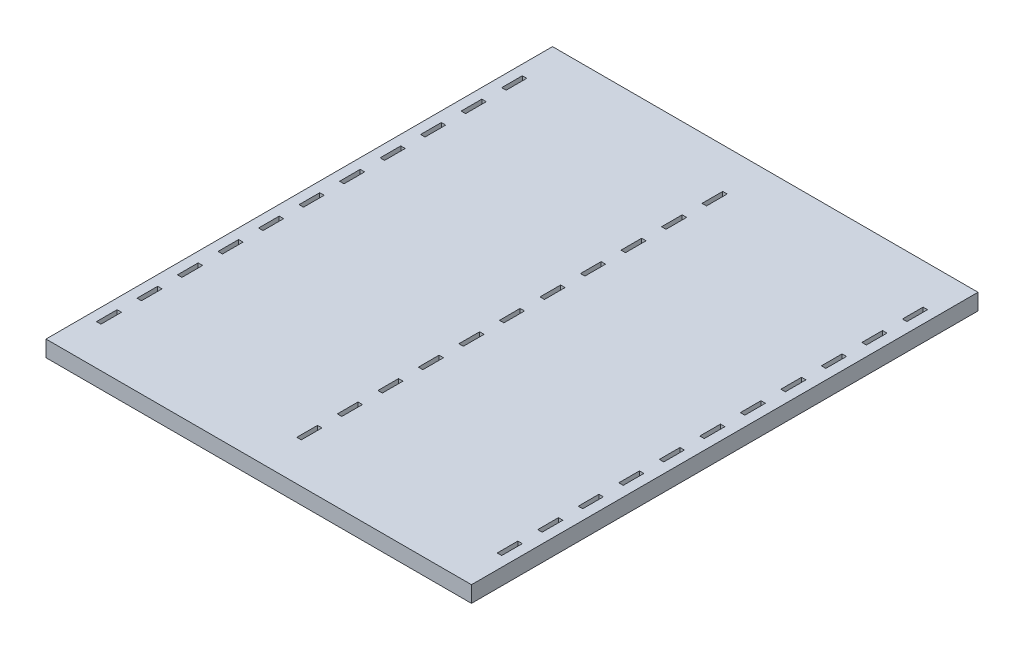
from build123d import *

# Parameters (mm, degrees)
SKETCH1_W           = 210
SKETCH1_H           = 250
BOSS_EXTRUDE1_DEPTH = 8
SKETCH_2_W          = 2.2
SKETCH_2_H          = 10.2
CUT_EXTRUDE_3_DEPTH = 164.444180074


with BuildPart() as part:
    # Sketch1 → Boss-Extrude1 (new body)
    with BuildSketch(Plane(origin=(0, 0, 0), x_dir=(1, 0, 0), z_dir=(0, 1, 0))):
        Rectangle(SKETCH1_W, SKETCH1_H)
    extrude(amount=BOSS_EXTRUDE1_DEPTH)

    # 草图2 → 切除-拉伸3 (cut, through all)
    with BuildSketch(Plane(origin=(0, 8, 0), x_dir=(1, 0, 0), z_dir=(0, 1, 0))):
        with Locations((0, -20)):
            Rectangle(SKETCH_2_W, SKETCH_2_H)
        Rectangle(SKETCH_2_W, SKETCH_2_H)
        with Locations((0, 20)):
            Rectangle(SKETCH_2_W, SKETCH_2_H)
        with Locations((0, 40)):
            Rectangle(SKETCH_2_W, SKETCH_2_H)
        with Locations((0, 60)):
            Rectangle(SKETCH_2_W, SKETCH_2_H)
        with Locations((0, 80)):
            Rectangle(SKETCH_2_W, SKETCH_2_H)
        with Locations((0, 100)):
            Rectangle(SKETCH_2_W, SKETCH_2_H)
        with Locations((0, -40)):
            Rectangle(SKETCH_2_W, SKETCH_2_H)
        with Locations((0, -60)):
            Rectangle(SKETCH_2_W, SKETCH_2_H)
        with Locations((0, -80)):
            Rectangle(SKETCH_2_W, SKETCH_2_H)
        with Locations((0, -100)):
            Rectangle(SKETCH_2_W, SKETCH_2_H)
        with Locations((98.9, 0)):
            Rectangle(SKETCH_2_W, SKETCH_2_H)
        with Locations((98.9, 20)):
            Rectangle(SKETCH_2_W, SKETCH_2_H)
        with Locations((-98.9, 0)):
            Rectangle(SKETCH_2_W, SKETCH_2_H)
        with Locations((98.9, 40)):
            Rectangle(SKETCH_2_W, SKETCH_2_H)
        with Locations((98.9, 60)):
            Rectangle(SKETCH_2_W, SKETCH_2_H)
        with Locations((98.9, 80)):
            Rectangle(SKETCH_2_W, SKETCH_2_H)
        with Locations((98.9, 100)):
            Rectangle(SKETCH_2_W, SKETCH_2_H)
        with Locations((98.9, -20)):
            Rectangle(SKETCH_2_W, SKETCH_2_H)
        with Locations((98.9, -40)):
            Rectangle(SKETCH_2_W, SKETCH_2_H)
        with Locations((98.9, -60)):
            Rectangle(SKETCH_2_W, SKETCH_2_H)
        with Locations((98.9, -80)):
            Rectangle(SKETCH_2_W, SKETCH_2_H)
        with Locations((98.9, -100)):
            Rectangle(SKETCH_2_W, SKETCH_2_H)
        with Locations((-98.9, 20)):
            Rectangle(SKETCH_2_W, SKETCH_2_H)
        with Locations((-98.9, 40)):
            Rectangle(SKETCH_2_W, SKETCH_2_H)
        with Locations((-98.9, 60)):
            Rectangle(SKETCH_2_W, SKETCH_2_H)
        with Locations((-98.9, 80)):
            Rectangle(SKETCH_2_W, SKETCH_2_H)
        with Locations((-98.9, 100)):
            Rectangle(SKETCH_2_W, SKETCH_2_H)
        with Locations((-98.9, -20)):
            Rectangle(SKETCH_2_W, SKETCH_2_H)
        with Locations((-98.9, -40)):
            Rectangle(SKETCH_2_W, SKETCH_2_H)
        with Locations((-98.9, -60)):
            Rectangle(SKETCH_2_W, SKETCH_2_H)
        with Locations((-98.9, -80)):
            Rectangle(SKETCH_2_W, SKETCH_2_H)
        with Locations((-98.9, -100)):
            Rectangle(SKETCH_2_W, SKETCH_2_H)
    extrude(amount=-CUT_EXTRUDE_3_DEPTH, mode=Mode.SUBTRACT)


solid = part.part
